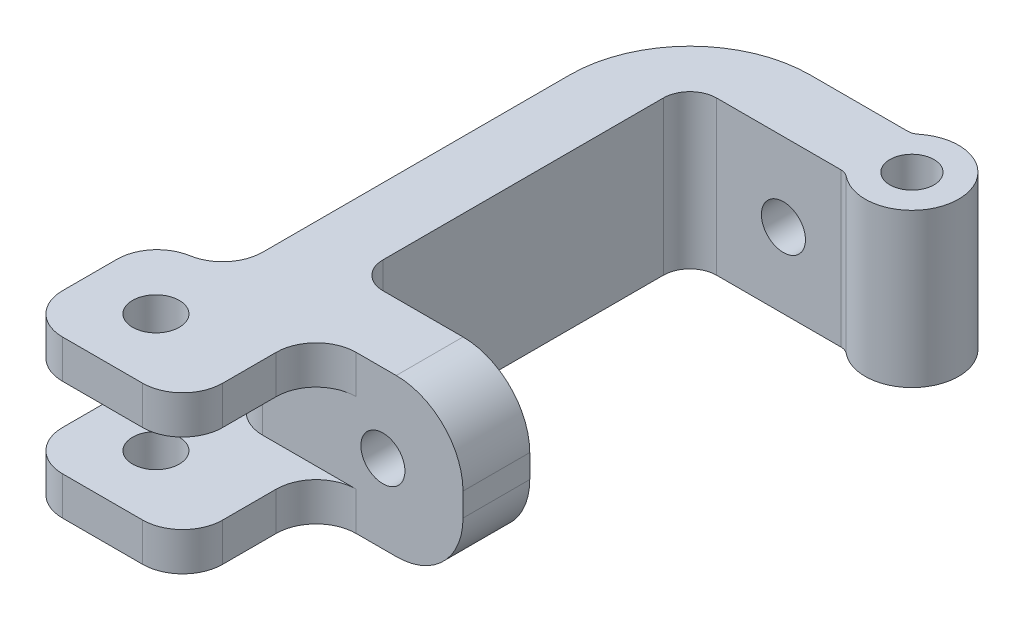
from build123d import *

# Parameters (mm, degrees)
SKETCH1_W               = 20.25
SKETCH1_H               = 11.5
BOSS_EXTRUDE1_DEPTH     = 5
SKETCH2_W               = 5
SKETCH2_H               = 11.5
BOSS_EXTRUDE2_DEPTH     = 25
SKETCH3_W               = 18
SKETCH3_H               = 11.75
BOSS_EXTRUDE3_DEPTH     = 5
CUT_EXTRUDE2_DEPTH      = 33.226008518
CUT_EXTRUDE2_DEPTH_BACK = 33.226008518
SKETCH5_R               = 1.65
FILLET1_R               = 9
FILLET7_R               = 5
CUT_EXTRUDE4_DEPTH      = 39.206879289
CUT_EXTRUDE4_DEPTH_BACK = 39.206879289
SKETCH10_R              = 1.65
SKETCH10_4_R            = 3.5
SKETCH10_4_R_2          = 1.65
BOSS_EXTRUDE7_DEPTH     = 11.5
FILLET13_R              = 1
FILLET16_R              = 2
SKETCH11_W              = 12
SKETCH11_H              = 2.875
BOSS_EXTRUDE8_DEPTH     = 10
CUT_EXTRUDE5_DEPTH      = 49.906319888
CUT_EXTRUDE5_DEPTH_BACK = 49.906319888
SKETCH12_R              = 1.75
FILLET17_R              = 3
FILLET18_R              = 3
FILLET19_R              = 3
FILLET20_R              = 2


with BuildPart() as part:
    # Sketch1 → Boss-Extrude1 (new body)
    with BuildSketch(Plane.XY):
        Rectangle(SKETCH1_W, SKETCH1_H)
    extrude(amount=BOSS_EXTRUDE1_DEPTH)

    # Sketch2 → Boss-Extrude2 (add)
    with BuildSketch(Plane.XY.offset(5)):
        with Locations((-7.625, 0)):
            Rectangle(SKETCH2_W, SKETCH2_H)
    extrude(amount=BOSS_EXTRUDE2_DEPTH)

    # Sketch3 → Boss-Extrude3 (add)
    with BuildSketch(Plane.XY.offset(30)):
        with Locations((-1.125, -0.125)):
            Rectangle(SKETCH3_W, SKETCH3_H)
    extrude(amount=BOSS_EXTRUDE3_DEPTH)

    # Sketch5 → Cut-Extrude2 (cut, two sides: drawn at the far end of the back side and taken through both)
    with BuildSketch(Plane(origin=(0, 0, 30), x_dir=(-1, 0, 0), z_dir=(0, 0, -1)).offset(-CUT_EXTRUDE2_DEPTH_BACK)):
        with Locations((-1.875, -0.125)):
            Circle(SKETCH5_R)
    extrude(amount=CUT_EXTRUDE2_DEPTH + CUT_EXTRUDE2_DEPTH_BACK, mode=Mode.SUBTRACT)

    # Fillet1
    fillet1_edges = [part.edges().sort_by_distance(p)[0] for p in [
        (-10.125, 0, 0),
    ]]
    fillet(fillet1_edges, radius=FILLET1_R)

    # Fillet7
    fillet7_edges = [part.edges().sort_by_distance(p)[0] for p in [
        (7.875, -6, 32.5),
        (7.875, 5.75, 32.5),
    ]]
    fillet(fillet7_edges, radius=FILLET7_R)

    # Sketch10 → Cut-Extrude4 (cut, two sides: drawn at the far end of the back side and taken through both)
    with BuildSketch(Plane.XZ.offset(5.75).offset(-CUT_EXTRUDE4_DEPTH_BACK)):
        with Locations((9, 2.5)):
            Circle(SKETCH10_R)
    extrude(amount=CUT_EXTRUDE4_DEPTH + CUT_EXTRUDE4_DEPTH_BACK, mode=Mode.SUBTRACT)

    # Sketch10<4> → Boss-Extrude7 (add)
    with BuildSketch(Plane.XZ.offset(5.75)):
        with Locations((9, 2.5)):
            Circle(SKETCH10_4_R)
        with Locations((9, 2.5)):
            Circle(SKETCH10_4_R_2, mode=Mode.SUBTRACT)
    extrude(amount=-BOSS_EXTRUDE7_DEPTH)

    # Fillet13
    fillet13_edges = [part.edges().sort_by_distance(p)[0] for p in [
        (6.550510257, 0, 0),
        (6.550510257, 0, 5),
    ]]
    fillet(fillet13_edges, radius=FILLET13_R)

    # Fillet16
    fillet16_edges = [part.edges().sort_by_distance(p)[0] for p in [
        (-5.125, 0, 5),
    ]]
    fillet(fillet16_edges, radius=FILLET16_R)

    # Sketch11 → Boss-Extrude8 (add)
    with BuildSketch(Plane.XY.offset(35)):
        with Locations((-9.125, 4.3125)):
            Rectangle(SKETCH11_W, SKETCH11_H)
        with Locations((-9.125, -4.5625)):
            Rectangle(SKETCH11_W, SKETCH11_H)
    extrude(amount=BOSS_EXTRUDE8_DEPTH)

    # Sketch12 → Cut-Extrude5 (cut, two sides: drawn at the far end of the back side and taken through both)
    with BuildSketch(Plane(origin=(0, 5.75, 0), x_dir=(1, 0, 0), z_dir=(0, 1, 0)).offset(-CUT_EXTRUDE5_DEPTH_BACK)):
        with Locations((-10.125, -40)):
            Circle(SKETCH12_R)
    extrude(amount=CUT_EXTRUDE5_DEPTH + CUT_EXTRUDE5_DEPTH_BACK, mode=Mode.SUBTRACT)

    # Fillet17
    fillet17_edges = [part.edges().sort_by_distance(p)[0] for p in [
        (-3.125, 4.3125, 35),
        (-3.125, 4.3125, 45),
        (-15.125, 4.3125, 45),
        (-10.125, 4.3125, 35),
        (-3.125, -4.5625, 35),
        (-3.125, -4.5625, 45),
        (-15.125, -4.5625, 45),
        (-10.125, -4.5625, 35),
    ]]
    fillet(fillet17_edges, radius=FILLET17_R)

    # Fillet18
    fillet18_edges = [part.edges().sort_by_distance(p)[0] for p in [
        (-15.125, 4.3125, 35),
        (-15.125, -4.5625, 35),
    ]]
    fillet(fillet18_edges, radius=FILLET18_R)

    # Fillet19
    fillet19_edges = [part.edges().sort_by_distance(p)[0] for p in [
        (-10.125, -0.125, 35),
    ]]
    fillet(fillet19_edges, radius=FILLET19_R)

    # Fillet20
    fillet20_edges = [part.edges().sort_by_distance(p)[0] for p in [
        (-5.125, 0, 30),
    ]]
    fillet(fillet20_edges, radius=FILLET20_R)


solid = part.part
